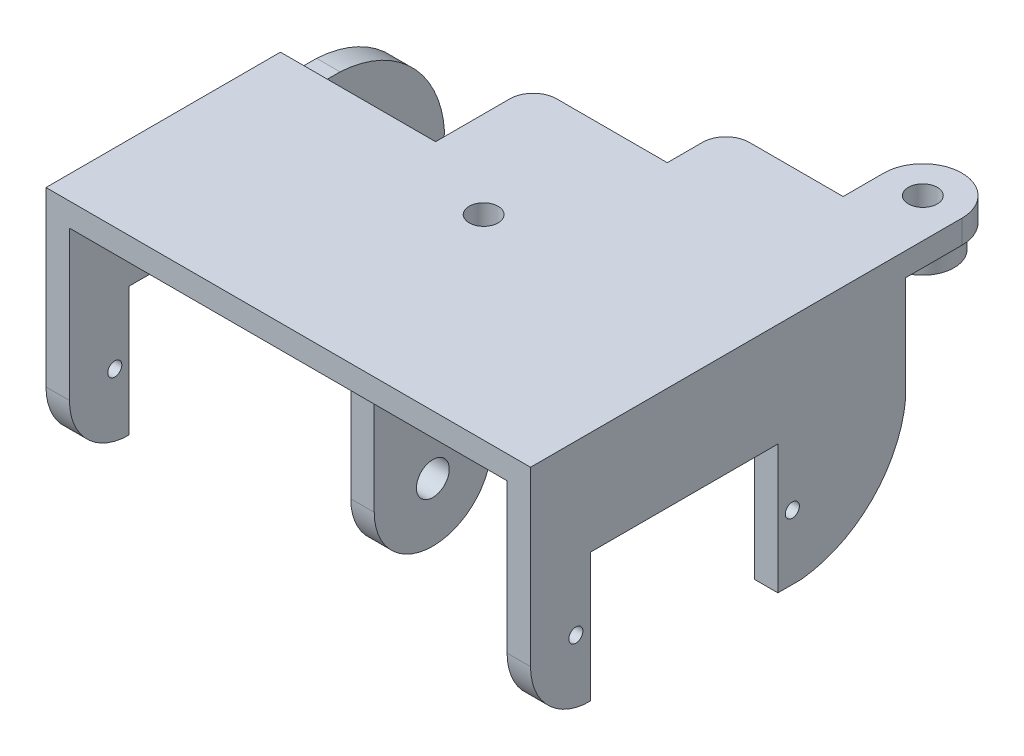
from build123d import *

# Parameters (mm, degrees)
SKETCH1_R               = 1.85
BOSS_EXTRUDE1_DEPTH     = 3
SKETCH2_W               = 3
SKETCH2_H               = 48
BOSS_EXTRUDE2_DEPTH     = 26.75
SKETCH4_W               = 24
SKETCH4_H               = 16.5
SKETCH4_R               = 0.9
CUT_EXTRUDE3_DEPTH      = 3
CUT_EXTRUDE4_DEPTH      = 92.395308961
CUT_EXTRUDE4_DEPTH_BACK = 3
SKETCH6_W               = 3
SKETCH6_H               = 15
BOSS_EXTRUDE3_DEPTH     = 26.75
CUT_EXTRUDE5_DEPTH      = 6
SKETCH8_R               = 2.1
CUT_EXTRUDE6_DEPTH      = 6
FILLET2_R               = 3
SKETCH10_R              = 4
SKETCH10_R_2            = 1.85
BOSS_EXTRUDE4_DEPTH     = 3


with BuildPart() as part:
    # Sketch1 → Boss-Extrude1 (new body)
    with BuildSketch(Plane(origin=(0, 0, 0), x_dir=(1, 0, 0), z_dir=(0, 1, 0))):
        with BuildLine():
            Line((52, 55.2), (52, 50))
            Line((52, 50), (37, 50))
            Line((37, 50), (37, 42.5))
            Line((37, 42.5), (19.85, 42.5))
            Line((19.85, 42.5), (19.85, 30))
            Line((19.85, 30), (0, 30))
            Line((0, 30), (0, 0))
            Line((0, 0), (62, 0))
            Line((62, 0), (62, 50))
            Line((62, 50), (62, 55.2))
            ThreePointArc((62, 55.2), (57, 60.2), (52, 55.2))
        make_face()
        with Locations(Location((31, 25, 0), (0, 0, 270))):
            Circle(SKETCH1_R, mode=Mode.SUBTRACT)
        with Locations(Location((57, 55.2, 0), (0, 0, 270))):
            Circle(SKETCH1_R, mode=Mode.SUBTRACT)
    extrude(amount=-BOSS_EXTRUDE1_DEPTH)

    # Sketch2 → Boss-Extrude2 (add)
    with BuildSketch(Plane(origin=(0, -3, 0), x_dir=(-1, 0, 0), z_dir=(0, -1, 0))):
        with Locations((-60.5, 24)):
            Rectangle(SKETCH2_W, SKETCH2_H)
        with Locations((-1.5, 24)):
            Rectangle(SKETCH2_W, SKETCH2_H)
    extrude(amount=BOSS_EXTRUDE2_DEPTH)

    # Sketch4 → Cut-Extrude3 (cut)
    with BuildSketch(Plane.ZY.offset(-62)):
        with BuildLine():
            Line((-48, -29.75), (-34.625, -29.75))
            ThreePointArc((-34.625, -29.75), (-43.69937868, -25.44937868), (-48, -16.375))
            Line((-48, -16.375), (-48, -29.75))
        make_face()
        with Locations((-19.65, -21.5)):
            Rectangle(SKETCH4_W, SKETCH4_H)
        with BuildLine():
            ThreePointArc((0, -22.1), (-2.240633124, -27.509366876), (-7.65, -29.75))
            Line((-7.65, -29.75), (0, -29.75))
            Line((0, -29.75), (0, -22.1))
        make_face()
        with Locations((-33.5, -21.5)):
            Circle(SKETCH4_R)
        with Locations(Location((-5.8, -21.5, 0), (0, 0, 180))):
            Circle(SKETCH4_R)
    cut_extrude3 = extrude(amount=CUT_EXTRUDE3_DEPTH, mode=Mode.SUBTRACT)

    # Mirror2: Cut-Extrude3 across plane
    add(cut_extrude3.mirror(Plane(origin=(31, 0, 0), x_dir=(0, 0, 1), z_dir=(1, 0, 0))), mode=Mode.SUBTRACT)

    # Sketch5 → Cut-Extrude4 (cut, two sides: drawn at the far end of the back side and taken through both)
    with BuildSketch(Plane.ZY.offset(-CUT_EXTRUDE4_DEPTH_BACK)):
        with BuildLine():
            Line((-48, -3), (-48, -16.375))
            ThreePointArc((-48, -16.375), (-43.861015127, -7.138984873), (-34.625, -3))
            Line((-34.625, -3), (-48, -3))
        make_face()
    extrude(amount=CUT_EXTRUDE4_DEPTH + CUT_EXTRUDE4_DEPTH_BACK, mode=Mode.SUBTRACT)

    # Sketch6 → Boss-Extrude3 (add)
    with BuildSketch(Plane(origin=(0, -3, 0), x_dir=(-1, 0, 0), z_dir=(0, -1, 0))):
        with Locations((-34, 33.899748742)):
            Rectangle(SKETCH6_W, SKETCH6_H)
        with Locations((-34, 14)):
            Rectangle(SKETCH6_W, SKETCH6_H)
    extrude(amount=BOSS_EXTRUDE3_DEPTH)

    # Sketch7 → Cut-Extrude5 (cut)
    with BuildSketch(Plane.ZY.offset(-32.5)):
        with BuildLine():
            Line((-6.5, -29.75), (-6.5, -21.5))
            ThreePointArc((-6.5, -21.5), (-14, -29), (-21.5, -21.5))
            Line((-21.5, -21.5), (-21.5, -29.75))
            Line((-21.5, -29.75), (-6.5, -29.75))
        make_face()
        with BuildLine():
            ThreePointArc((-16.1, -21.5), (-14, -23.6), (-11.9, -21.5))
            Line((-11.9, -21.5), (-16.1, -21.5))
        make_face()
        with BuildLine():
            Line((-16.1, -21.5), (-11.9, -21.5))
            ThreePointArc((-11.9, -21.5), (-14, -19.4), (-16.1, -21.5))
        make_face()
    extrude(amount=-CUT_EXTRUDE5_DEPTH, mode=Mode.SUBTRACT)

    # Sketch8 → Cut-Extrude6 (cut)
    with BuildSketch(Plane.ZY.offset(-32.5)):
        with Locations((-33.899748742, -21.5)):
            Circle(SKETCH8_R)
        with BuildLine():
            ThreePointArc((-26.399748742, -21.5), (-33.899748742, -29), (-41.399748742, -21.5))
            Line((-41.399748742, -21.5), (-41.399748742, -29.75))
            Line((-41.399748742, -29.75), (-26.399748742, -29.75))
            Line((-26.399748742, -29.75), (-26.399748742, -21.5))
        make_face()
    extrude(amount=-CUT_EXTRUDE6_DEPTH, mode=Mode.SUBTRACT)

    # Fillet2
    fillet2_edges = [part.edges().sort_by_distance(p)[0] for p in [
        (19.85, -1.5, -42.5),
        (37, -1.5, -50),
    ]]
    fillet(fillet2_edges, radius=FILLET2_R)

    # Sketch10 → Boss-Extrude4 (add)
    with BuildSketch(Plane.XZ.offset(3)):
        with Locations(Location((57, -55.2, 0), (0, 0, 90))):
            Circle(SKETCH10_R)
        with Locations(Location((57, -55.2, 0), (0, 0, 90))):
            Circle(SKETCH10_R_2, mode=Mode.SUBTRACT)
    extrude(amount=BOSS_EXTRUDE4_DEPTH)


solid = part.part
